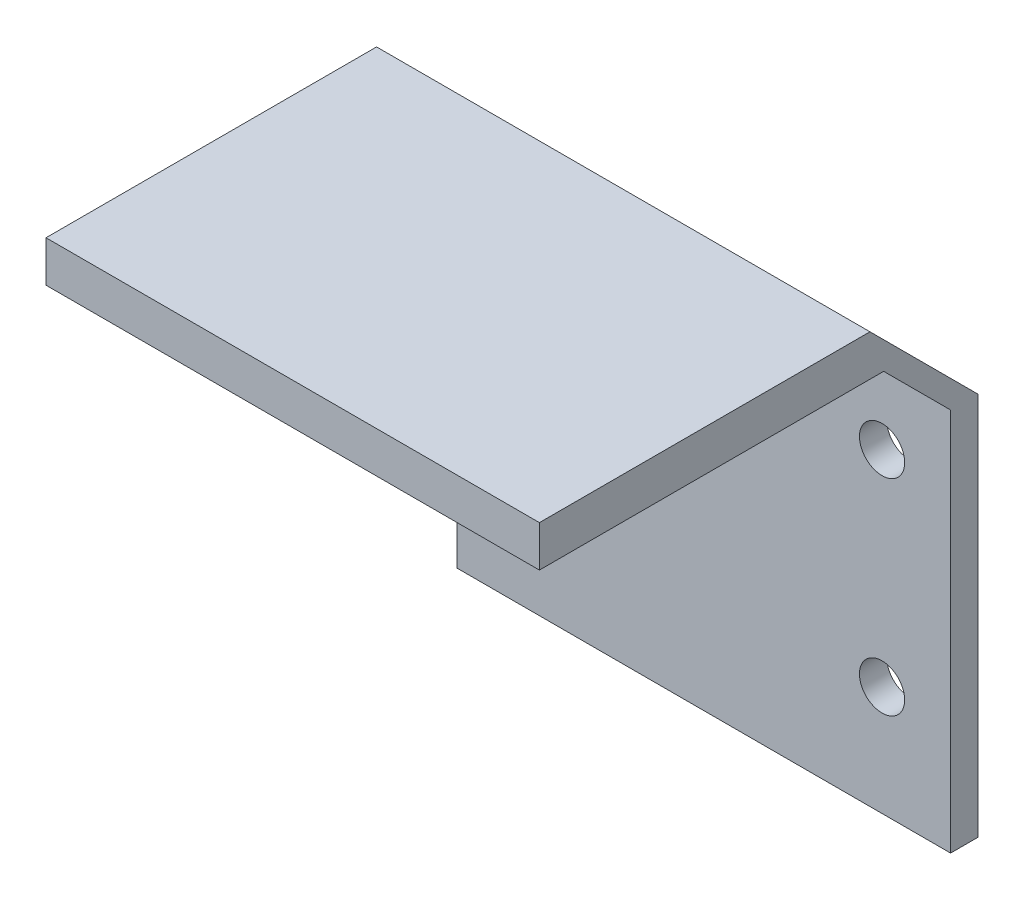
from build123d import *

# Parameters (mm, degrees)
SKETCH_1_W          = 36
SKETCH_1_H          = 28
EXTRUDE_1_DEPTH     = 2
EXTRUDE_2_DEPTH     = 36
SKETCH_3_R          = 1.65
CUT_EXTRUDE_1_DEPTH = 4


with BuildPart() as part:
    # 草图1 → 凸台-拉伸1 (new body)
    with BuildSketch(Plane.XY):
        with Locations((18, 14)):
            Rectangle(SKETCH_1_W, SKETCH_1_H)
    extrude(amount=EXTRUDE_1_DEPTH)

    # 草图2 → 凸台-拉伸2 (add)
    with BuildSketch(Plane(origin=(36, 0, 0), x_dir=(0, 0, -1), z_dir=(1, 0, 0))):
        Polygon((-6.882121938, 32.882121938), (-2, 28), (0, 28), (-7.882121938, 35.882121938), (-32, 35.882121938), (-32, 32.882121938), align=None)
    extrude(amount=-EXTRUDE_2_DEPTH)

    # 草图3 → 切除-拉伸1 (cut)
    with BuildSketch(Plane.XY.offset(2)):
        with Locations((31, 23)):
            Circle(SKETCH_3_R)
        with Locations((6, 23)):
            Circle(SKETCH_3_R)
        with Locations((6, 8)):
            Circle(SKETCH_3_R)
        with Locations((31, 8)):
            Circle(SKETCH_3_R)
    extrude(amount=-CUT_EXTRUDE_1_DEPTH, mode=Mode.SUBTRACT)


solid = part.part
